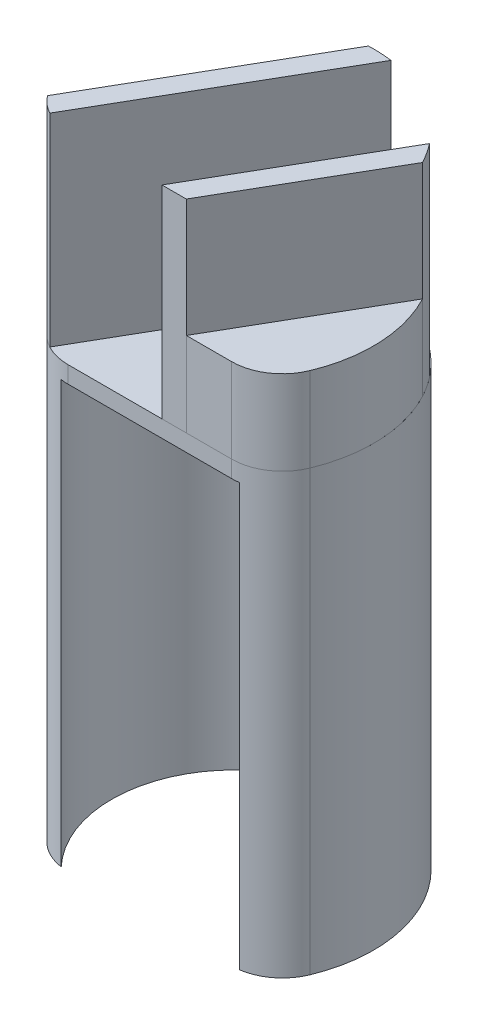
from build123d import *

# Parameters (mm, degrees)
SKETCH_1_R          = 16.5
SKETCH_1_R_2        = 14.5
EXTRUDE_1_DEPTH     = 35
SKETCH_3_R          = 16.5
EXTRUDE_2_DEPTH     = 2
SKETCH_4_W          = 78.350079852
SKETCH_4_H          = 91.802514566
CUT_EXTRUDE_1_DEPTH = 49.40970977
CUT_EXTRUDE_2_REACH = 45.744
SKETCH_5_R          = 3.75
FILLET_1_R          = 6
EXTRUDE_3_DEPTH     = 24
EXTRUDE_3_2_DEPTH   = 24
EXTRUDE_7_DEPTH     = 10
EXTRUDE_START       = 15
EXTRUDE_8_DEPTH     = 15
EXTRUDE_10_DEPTH    = 40


with BuildPart() as part:
    # 草图1 → 凸台-拉伸1 (new body)
    with BuildSketch(Plane(origin=(0, 0, 0), x_dir=(1, 0, 0), z_dir=(0, 1, 0))):
        with Locations(Location((0, 0, 0), (0, 0, 270))):
            Circle(SKETCH_1_R)
        with Locations(Location((0, 0, 0), (0, 0, 270))):
            Circle(SKETCH_1_R_2, mode=Mode.SUBTRACT)
    extrude(amount=EXTRUDE_1_DEPTH)

    # 草图3 → 凸台-拉伸2 (add)
    with BuildSketch(Plane(origin=(0, 35, 0), x_dir=(1, 0, 0), z_dir=(0, 1, 0))):
        with Locations(Location((0, 0, 0), (0, 0, 270))):
            Circle(SKETCH_3_R)
    extrude(amount=EXTRUDE_2_DEPTH)

    # 草图4 → 切除-拉伸1 (cut, through all)
    with BuildSketch(Plane.XY.offset(10)):
        with Locations((-10.760491613, -6.179419868)):
            Rectangle(SKETCH_4_W, SKETCH_4_H)
    extrude(amount=CUT_EXTRUDE_1_DEPTH, mode=Mode.SUBTRACT)

    # 草图5 → 切除-拉伸2 (cut, up to next)
    with BuildSketch(Plane(origin=(0, 37, 0), x_dir=(1, 0, 0), z_dir=(0, 1, 0)), mode=Mode.PRIVATE) as cut_extrude_2_sk1:
        with Locations(Location((0, 0, 0), (0, 0, 270))):
            Circle(SKETCH_5_R)
    cut_extrude_2_tool1 = extrude(cut_extrude_2_sk1.sketch, amount=-CUT_EXTRUDE_2_REACH, mode=Mode.PRIVATE) & part.part
    add(cut_extrude_2_tool1.solids().sort_by_distance((0, 37, 0))[0], mode=Mode.SUBTRACT)

    # 圆角1
    fillet_1_edges = [part.edges().sort_by_distance(p)[0] for p in [
        (13.124404748, 18.5, 10),
        (-13.124404748, 18.5, 10),
    ]]
    fillet(fillet_1_edges, radius=FILLET_1_R)

    # 草图10 → 凸台-拉伸8 (add)
    with BuildSketch(Plane.XZ.offset(EXTRUDE_START)):
        with BuildLine():
            ThreePointArc((-15.255811873, 6.285714286), (0, -16.5), (15.255811873, 6.285714286))
            ThreePointArc((15.255811873, 6.285714286), (13.391521243, 8.736398226), (10.557154474, 9.939642318))
            ThreePointArc((10.557154474, 9.939642318), (0, -14.5), (-10.557154474, 9.939642318))
            ThreePointArc((-10.557154474, 9.939642318), (-13.391521243, 8.736398226), (-15.255811873, 6.285714286))
        make_face()
    extrude(amount=-EXTRUDE_8_DEPTH)


with BuildPart() as body_2:
    # 草图6 → 凸台-拉伸3 (new body)
    with BuildSketch(Plane(origin=(0, 37, 0), x_dir=(1, 0, 0), z_dir=(0, 1, 0))):
        with BuildLine():
            Line((13.047897801, 10.099621923), (1.443375673, -10))
            Line((1.443375673, -10), (4.330127019, -10))
            Line((4.330127019, -10), (14.5721397, 7.739686335))
            ThreePointArc((14.5721397, 7.739686335), (13.860337004, 8.952153826), (13.047897801, 10.099621923))
        make_face()
    extrude(amount=EXTRUDE_3_DEPTH)


with BuildPart() as body_3:
    # 草图6 → Extrude 3 2 (new body)
    with BuildSketch(Plane(origin=(0, 37, 0), x_dir=(1, 0, 0), z_dir=(0, 1, 0))):
        with BuildLine():
            Line((-0.583304866, 16.489686335), (-14.498767089, -7.612601246))
            ThreePointArc((-14.498767089, -7.612601246), (-13.623792058, -8.546260307), (-12.570735662, -9.273152854))
            Line((-12.570735662, -9.273152854), (2.222580253, 16.349621923))
            ThreePointArc((2.222580253, 16.349621923), (0.82262413, 16.479480864), (-0.583304866, 16.489686335))
        make_face()
    extrude(amount=EXTRUDE_3_2_DEPTH)


with BuildPart() as body_4:
    # 草图9 → 凸台-拉伸7 (new body)
    with BuildSketch(Plane(origin=(0, 37, 0), x_dir=(1, 0, 0), z_dir=(0, 1, 0))):
        with BuildLine():
            Line((4.330127019, -10), (9.708243919, -10))
            ThreePointArc((9.708243919, -10), (13.046335761, -8.985693819), (15.255811873, -6.285714286))
            ThreePointArc((15.255811873, -6.285714286), (16.480432015, 0.803343383), (14.5721397, 7.739686335))
            Line((14.5721397, 7.739686335), (4.330127019, -10))
        make_face()
    extrude(amount=EXTRUDE_7_DEPTH)


with BuildPart() as body_5:
    # 草图12 → 凸台-拉伸10 (new body)
    with BuildSketch(Plane(origin=(0, 37, 0), x_dir=(1, 0, 0), z_dir=(0, 1, 0))):
        with BuildLine():
            Line((-16.432532581, 3.801536896), (-13.012331148, 13.198463104))
            Line((-13.012331148, 13.198463104), (-10.865728221, 12.417163534))
            ThreePointArc((-10.865728221, 12.417163534), (-14.166768538, 8.458881084), (-16.085482597, 3.675221032))
            Line((-16.085482597, 3.675221032), (-16.432532581, 3.801536896))
        make_face()
    extrude(amount=-EXTRUDE_10_DEPTH)


solid = Compound([part.part, body_2.part, body_3.part, body_4.part, body_5.part])
